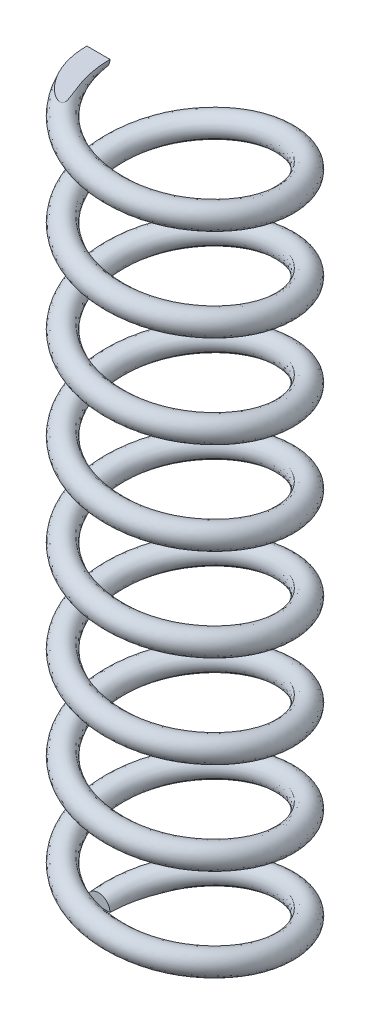
from build123d import *

# Parameters (mm, degrees)
SWEEP2_PITCH       = 0.8
SWEEP2_HEIGHT      = 6.4
SWEEP2_RADIUS      = 0.75
SWEEP2_START_ANGLE = -90
SKETCH3_R          = 0.1
SKETCH4_W          = 4
SKETCH4_H          = 0.70629387
SKETCH4_H_2        = 0.5
CUT_EXTRUDE1_DEPTH = 5


with BuildPart() as part:
    # Sweep2: sweep along a helix
    with BuildLine() as sweep2_path:
        add(Helix(SWEEP2_PITCH, SWEEP2_HEIGHT, SWEEP2_RADIUS, center=(0, 0, 0), direction=(0, 1, 0), lefthand=True, mode=Mode.PRIVATE).rotate(Axis((0, 0, 0), (0, 1, 0)), SWEEP2_START_ANGLE))
    # Sketch3 → Sweep2 (sweep)
    with BuildSketch(Plane.XY):
        with Locations((-0.75, 0)):
            Circle(SKETCH3_R)
    sweep(path=sweep2_path.line, is_frenet=True)

    # Sketch4 → Cut-Extrude1 (cut, symmetric)
    with BuildSketch(Plane(origin=(0, 0, 0), x_dir=(0, 0, -1), z_dir=(1, 0, 0))):
        with Locations((0, 6.753146935)):
            Rectangle(SKETCH4_W, SKETCH4_H)
        with Locations((0, -0.25)):
            Rectangle(SKETCH4_W, SKETCH4_H_2)
    extrude(amount=CUT_EXTRUDE1_DEPTH, both=True, mode=Mode.SUBTRACT)


solid = part.part
